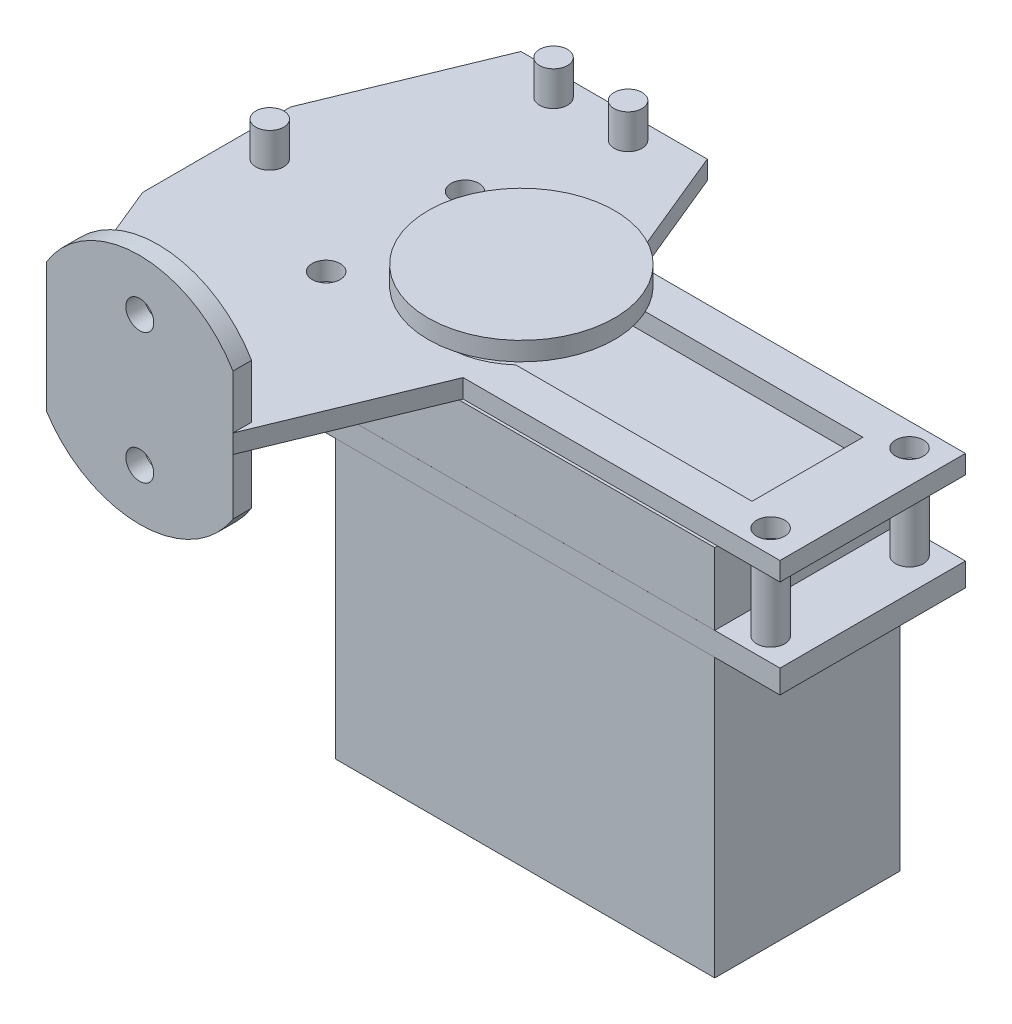
from build123d import *

# Parameters (mm, degrees)
SKETCH_1_W          = 40.7
SKETCH_1_H          = 19.9
EXTRUDE_1_DEPTH     = 40
SKETCH_2_R          = 3
EXTRUDE_2_DEPTH     = 6
EXTRUDE_START       = -7.7
SKETCH_3_W          = 54.7
SKETCH_3_H          = 19.901230414
EXTRUDE_3_DEPTH     = 2.5
SKETCH_4_R          = 10
EXTRUDE_4_DEPTH     = 2
SKETCH_5_R          = 1.5
EXTRUDE_5_DEPTH     = 8
SKETCH_7_R          = 1.5
EXTRUDE_6_DEPTH     = 2
SKETCH_8_W          = 20
SKETCH_8_H          = 2
EXTRUDE_7_DEPTH     = 11.5
SKETCH_9_W          = 20
SKETCH_9_H          = 2
EXTRUDE_8_DEPTH     = 11.5
SKETCH_10_R         = 1.5
CUT_EXTRUDE_1_DEPTH = 6.5
SKETCH_11_R         = 1.5
CUT_EXTRUDE_2_DEPTH = 6.5
CUT_EXTRUDE_3_DEPTH = 6.5
SKETCH_15_R         = 1.5
EXTRUDE_9_DEPTH     = 3.7
EXTRUDE_9_2_DEPTH   = 3.7
EXTRUDE_9_3_DEPTH   = 3.7


with BuildPart() as part:
    # 스케치1 → 보스-돌출1 (new body)
    with BuildSketch(Plane(origin=(0, 0, 0), x_dir=(1, 0, 0), z_dir=(0, 1, 0))):
        Rectangle(SKETCH_1_W, SKETCH_1_H)
    extrude(amount=EXTRUDE_1_DEPTH)

    # 스케치2 → 보스-돌출2 (add)
    with BuildSketch(Plane(origin=(0, 40, 0), x_dir=(1, 0, 0), z_dir=(0, 1, 0))):
        with Locations(Location((-10.35, 0, 0), (0, 0, 270))):
            Circle(SKETCH_2_R)
    extrude(amount=EXTRUDE_2_DEPTH)

    # 스케치3 → 보스-돌출3 (add)
    with BuildSketch(Plane(origin=(0, 40, 0), x_dir=(1, 0, 0), z_dir=(0, 1, 0)).offset(EXTRUDE_START)):
        Rectangle(SKETCH_3_W, SKETCH_3_H)
    extrude(amount=-EXTRUDE_3_DEPTH)

    # 스케치4 → 보스-돌출4 (add)
    with BuildSketch(Plane(origin=(0, 46, 0), x_dir=(1, 0, 0), z_dir=(0, 1, 0))):
        with Locations(Location((-10.35, 0, 0), (0, 0, 270))):
            Circle(SKETCH_4_R)
    extrude(amount=-EXTRUDE_4_DEPTH)

    # 스케치5 → 보스-돌출5 (add)
    with BuildSketch(Plane(origin=(0, 32.3, 0), x_dir=(1, 0, 0), z_dir=(0, 1, 0))):
        with Locations(Location((23.85, -7.450307604, 0), (0, 0, 270))):
            Circle(SKETCH_5_R)
        with Locations(Location((23.85, 7.450307604, 0), (0, 0, 270))):
            Circle(SKETCH_5_R)
        with Locations(Location((-23.85, -7.450307604, 0), (0, 0, 270))):
            Circle(SKETCH_5_R)
        with Locations(Location((-23.85, 7.450307604, 0), (0, 0, 270))):
            Circle(SKETCH_5_R)
    extrude(amount=EXTRUDE_5_DEPTH)


with BuildPart() as body_2:
    # 스케치7 → 보스-돌출6 (new body)
    with BuildSketch(Plane(origin=(0, 40.3, 0), x_dir=(1, 0, 0), z_dir=(0, 1, 0))):
        Polygon((27.35, -9.950615207), (27.35, 9.950615207), (-8.295701036, 9.950038115), (-13.85, 23.450307604), (-33.85, 23.450307604), (-41.050000006, 5.95), (-41.050000006, -9.95), (-33.85, -27.450307604), (-13.85, -27.450307604), (-6.649999994, -9.95), align=None)
        with Locations(Location((-23.85, -7.450307604, 0), (0, 0, 270))):
            Circle(SKETCH_7_R, mode=Mode.SUBTRACT)
        with Locations(Location((-23.85, 7.450307604, 0), (0, 0, 270))):
            Circle(SKETCH_7_R, mode=Mode.SUBTRACT)
        with Locations(Location((23.85, 7.450307604, 0), (0, 0, 270))):
            Circle(SKETCH_7_R, mode=Mode.SUBTRACT)
        with Locations(Location((23.85, -7.450307604, 0), (0, 0, 270))):
            Circle(SKETCH_7_R, mode=Mode.SUBTRACT)
        with BuildLine():
            Line((20.35, -5.95), (-5.002336959, -5.95))
            ThreePointArc((-5.002336959, -5.95), (-18.35, 0), (-5.002336959, 5.95))
            Line((-5.002336959, 5.95), (20.35, 5.95))
            Line((20.35, 5.95), (20.35, -5.95))
        make_face(mode=Mode.SUBTRACT)
    extrude(amount=EXTRUDE_6_DEPTH)

    # 스케치8 → 보스-돌출7 (add)
    with BuildSketch(Plane(origin=(0, 42.3, 0), x_dir=(1, 0, 0), z_dir=(0, 1, 0))):
        with Locations((-23.85, -26.450307604)):
            Rectangle(SKETCH_8_W, SKETCH_8_H)
    extrude(amount=EXTRUDE_7_DEPTH)

    # 스케치9 → 보스-돌출8 (add)
    with BuildSketch(Plane.XZ.offset(-40.3)):
        with Locations((-23.85, 26.450307604)):
            Rectangle(SKETCH_9_W, SKETCH_9_H)
    extrude(amount=EXTRUDE_8_DEPTH)

    # 스케치10 → 컷-돌출1 (cut)
    with BuildSketch(Plane.XY.offset(27.450307604)):
        with Locations((-23.85, 48.3)):
            Circle(SKETCH_10_R)
        with Locations((-23.85, 34.3)):
            Circle(SKETCH_10_R)
    extrude(amount=-CUT_EXTRUDE_1_DEPTH, mode=Mode.SUBTRACT)

    # 스케치11 → 컷-돌출2 (cut)
    with BuildSketch(Plane(origin=(0, 42.3, 0), x_dir=(1, 0, 0), z_dir=(0, 1, 0))):
        with Locations(Location((-37.35, 0, 0), (0, 0, 270))):
            Circle(SKETCH_11_R)
        with Locations(Location((-27.85, 20.950307604, 0), (0, 0, 270))):
            Circle(SKETCH_11_R)
        with Locations(Location((-19.85, 20.950307604, 0), (0, 0, 270))):
            Circle(SKETCH_11_R)
    extrude(amount=-CUT_EXTRUDE_2_DEPTH, mode=Mode.SUBTRACT)

    # 스케치12 → 컷-돌출3 (cut)
    with BuildSketch(Plane.XY.offset(27.450307604)):
        with BuildLine():
            ThreePointArc((-23.85, 28.8), (-29.556356105, 30.265716172), (-33.85, 34.3))
            Line((-33.85, 34.3), (-33.85, 28.8))
            Line((-33.85, 28.8), (-23.85, 28.8))
        make_face()
        with BuildLine():
            ThreePointArc((-13.85, 34.3), (-18.143643895, 30.265716172), (-23.85, 28.8))
            Line((-23.85, 28.8), (-13.85, 28.8))
            Line((-13.85, 28.8), (-13.85, 34.3))
        make_face()
        with BuildLine():
            Line((-33.85, 53.8), (-33.85, 48.213933245))
            ThreePointArc((-33.85, 48.213933245), (-29.604889153, 52.307994376), (-23.899083174, 53.8))
            Line((-23.899083174, 53.8), (-33.85, 53.8))
        make_face()
        with BuildLine():
            Line((-13.85, 53.8), (-23.899083174, 53.8))
            ThreePointArc((-23.899083174, 53.8), (-18.110158994, 52.260885957), (-13.85, 48.05))
            Line((-13.85, 48.05), (-13.85, 53.8))
        make_face()
    extrude(amount=-CUT_EXTRUDE_3_DEPTH, mode=Mode.SUBTRACT)


with BuildPart() as body_3:
    # 스케치15 → 보스-돌출9 (new body)
    with BuildSketch(Plane(origin=(0, 42.3, 0), x_dir=(1, 0, 0), z_dir=(0, 1, 0))):
        with Locations(Location((-27.85, 20.950307604, 0), (0, 0, 270))):
            Circle(SKETCH_15_R)
    extrude(amount=EXTRUDE_9_DEPTH)


with BuildPart() as body_4:
    # 스케치15 → Extrude 9 2 (new body)
    with BuildSketch(Plane(origin=(0, 42.3, 0), x_dir=(1, 0, 0), z_dir=(0, 1, 0))):
        with Locations(Location((-19.85, 20.950307604, 0), (0, 0, 270))):
            Circle(SKETCH_15_R)
    extrude(amount=EXTRUDE_9_2_DEPTH)


with BuildPart() as body_5:
    # 스케치15 → Extrude 9 3 (new body)
    with BuildSketch(Plane(origin=(0, 42.3, 0), x_dir=(1, 0, 0), z_dir=(0, 1, 0))):
        with Locations(Location((-37.35, 0, 0), (0, 0, 270))):
            Circle(SKETCH_15_R)
    extrude(amount=EXTRUDE_9_3_DEPTH)


solid = Compound([part.part, body_2.part, body_3.part, body_4.part, body_5.part])
